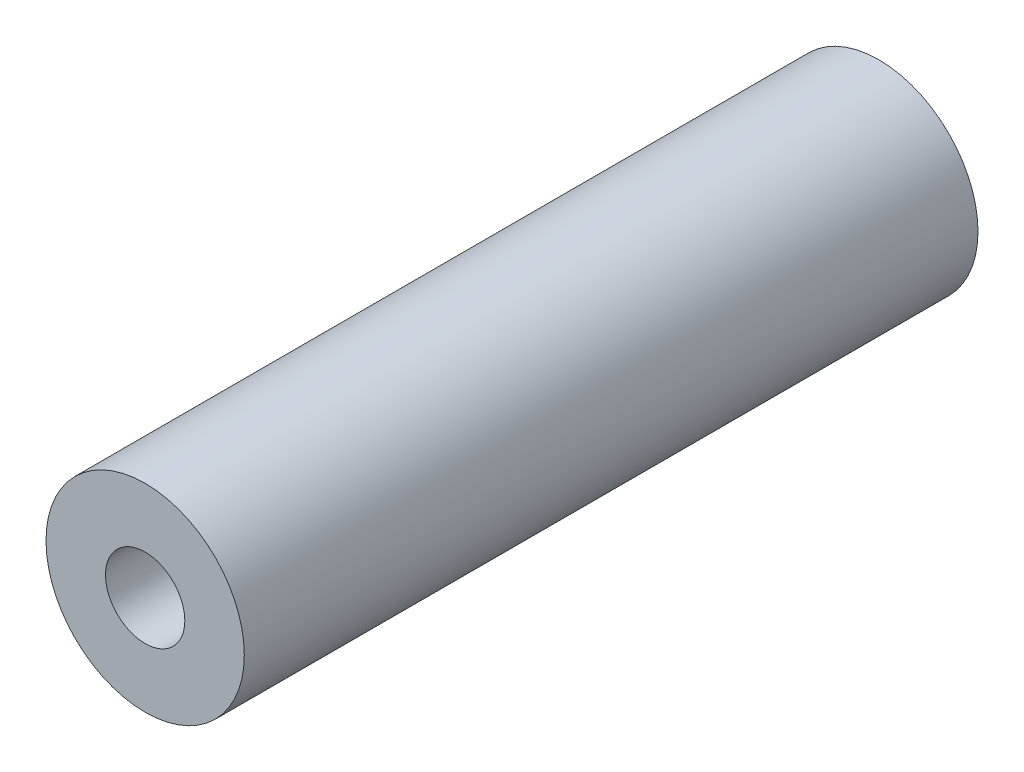
from build123d import *

# Parameters (mm, degrees)
SKETCH_1_R          = 5
EXTRUDE_1_DEPTH     = 37
SKETCH_2_R          = 2
CUT_EXTRUDE_1_DEPTH = 15
CUT_EXTRUDE_START   = -15
SKETCH_3_R          = 2
CUT_EXTRUDE_2_DEPTH = 15


with BuildPart() as part:
    # 스케치1 → 보스-돌출1 (new body)
    with BuildSketch(Plane.XY):
        Circle(SKETCH_1_R)
    extrude(amount=EXTRUDE_1_DEPTH)

    # 스케치2 → 컷-돌출1 (cut)
    with BuildSketch(Plane.XY.offset(37)):
        Circle(SKETCH_2_R)
    extrude(amount=-CUT_EXTRUDE_1_DEPTH, mode=Mode.SUBTRACT)

    # 스케치3 → 컷-돌출2 (cut)
    with BuildSketch(Plane(origin=(0, 0, 0), x_dir=(-1, 0, 0), z_dir=(0, 0, -1)).offset(CUT_EXTRUDE_START)):
        with Locations(Location((0, 0, 0), (0, 0, 180))):
            Circle(SKETCH_3_R)
    extrude(amount=CUT_EXTRUDE_2_DEPTH, mode=Mode.SUBTRACT)


solid = part.part
